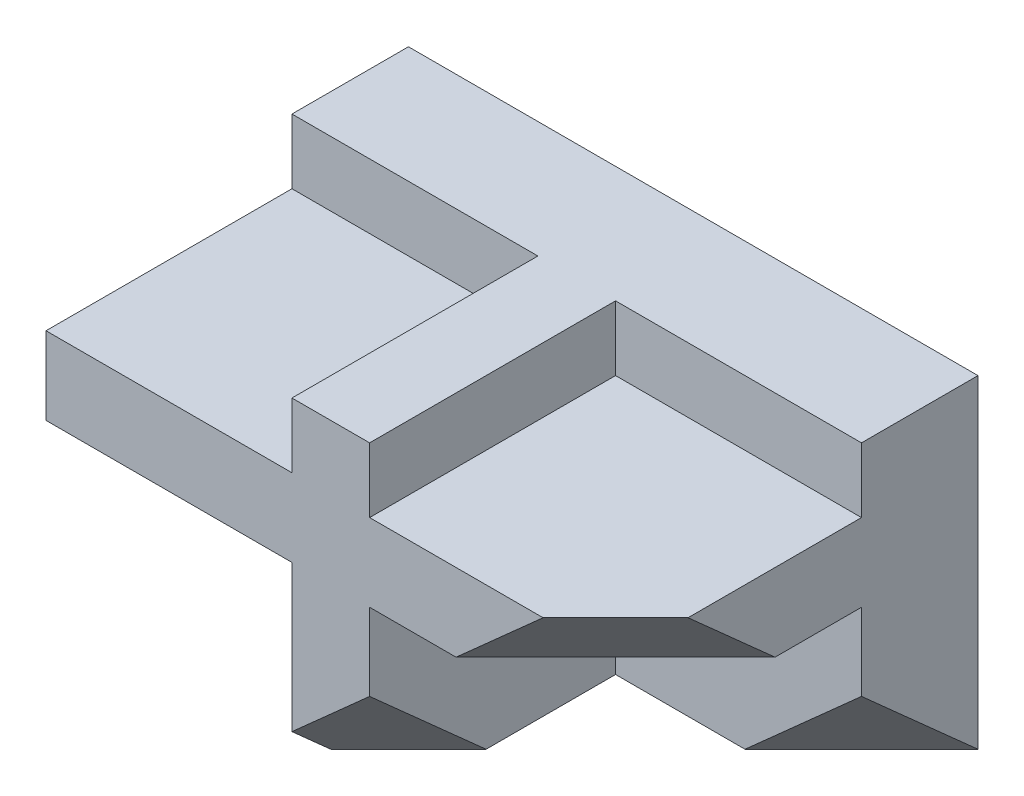
from build123d import *

# Parameters (mm, degrees)
SKETCH1_W           = 88
SKETCH1_H           = 50
BOSS_EXTRUDE1_DEPTH = 18
BOSS_EXTRUDE2_DEPTH = 38
CUT_EXTRUDE1_DEPTH  = 58


with BuildPart() as part:
    # Sketch1 → Boss-Extrude1 (new body)
    with BuildSketch(Plane.XY):
        Rectangle(SKETCH1_W, SKETCH1_H)
    extrude(amount=BOSS_EXTRUDE1_DEPTH)

    # Sketch2 → Boss-Extrude2 (add)
    with BuildSketch(Plane.XY.offset(18)):
        Polygon((-6, 25), (-6, 15), (-44, 15), (-44, 3), (-6, 3), (-6, -25), (6, -25), (6, 3), (44, 3), (44, 15), (6, 15), (6, 25), align=None)
    extrude(amount=BOSS_EXTRUDE2_DEPTH)

    # Sketch5 → Cut-Extrude1 (cut)
    with BuildSketch(Plane(origin=(22.123893805, -24.778761062, 22.123893805), x_dir=(0.8323002445923467, 0.4134919596981098, -0.3691892497304552), z_dir=(-0.5543250876981122, 0.6208440982218919, -0.5543250876981181))):
        Polygon((26.28391177, 16.650394233), (-40.999499912, -25.122114818), (26.28391177, -58.422903284), align=None)
    extrude(amount=-CUT_EXTRUDE1_DEPTH, mode=Mode.SUBTRACT)


solid = part.part
